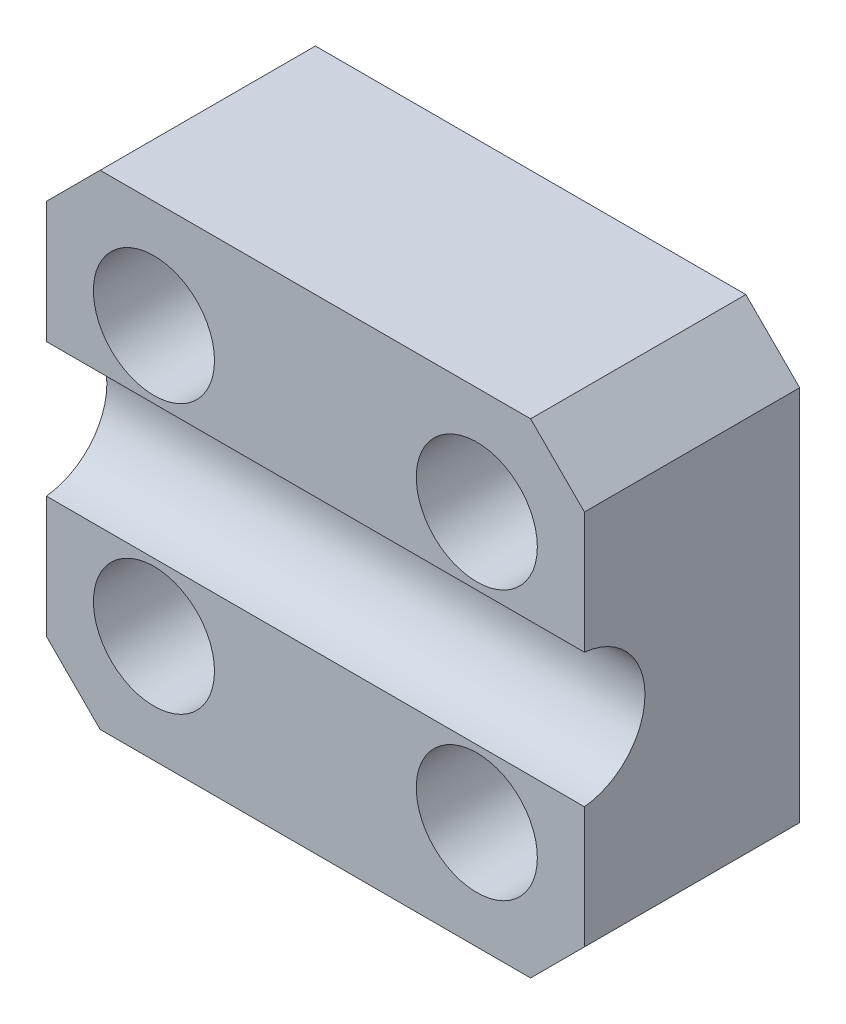
from build123d import *

# Parameters (mm, degrees)
SKETCH2_R           = 2.25
BOSS_EXTRUDE1_DEPTH = 8
CUT_EXTRUDE1_REACH  = 25.345
SKETCH3_R           = 2.5


with BuildPart() as part:
    # Sketch2 → Boss-Extrude1 (new body)
    with BuildSketch(Plane.XY):
        Polygon((-8, 9), (8, 9), (10, 7), (10, -7), (8, -9), (-8, -9), (-10, -7), (-10, 7), align=None)
        with Locations((-6, 5)):
            Circle(SKETCH2_R, mode=Mode.SUBTRACT)
        with Locations((-6, -5)):
            Circle(SKETCH2_R, mode=Mode.SUBTRACT)
        with Locations((6, 5)):
            Circle(SKETCH2_R, mode=Mode.SUBTRACT)
        with Locations((6, -5)):
            Circle(SKETCH2_R, mode=Mode.SUBTRACT)
    extrude(amount=BOSS_EXTRUDE1_DEPTH)

    # Sketch3 → Cut-Extrude1 (cut, up to next)
    with BuildSketch(Plane(origin=(10, 0, 0), x_dir=(0, 0, -1), z_dir=(1, 0, 0)), mode=Mode.PRIVATE) as cut_extrude1_sk1:
        with Locations((-8.25, 0)):
            Circle(SKETCH3_R)
    cut_extrude1_tool1 = extrude(cut_extrude1_sk1.sketch, amount=-CUT_EXTRUDE1_REACH, mode=Mode.PRIVATE) & part.part
    add(cut_extrude1_tool1.solids().sort_by_distance((10, 0, 8.25))[0], mode=Mode.SUBTRACT)


solid = part.part
